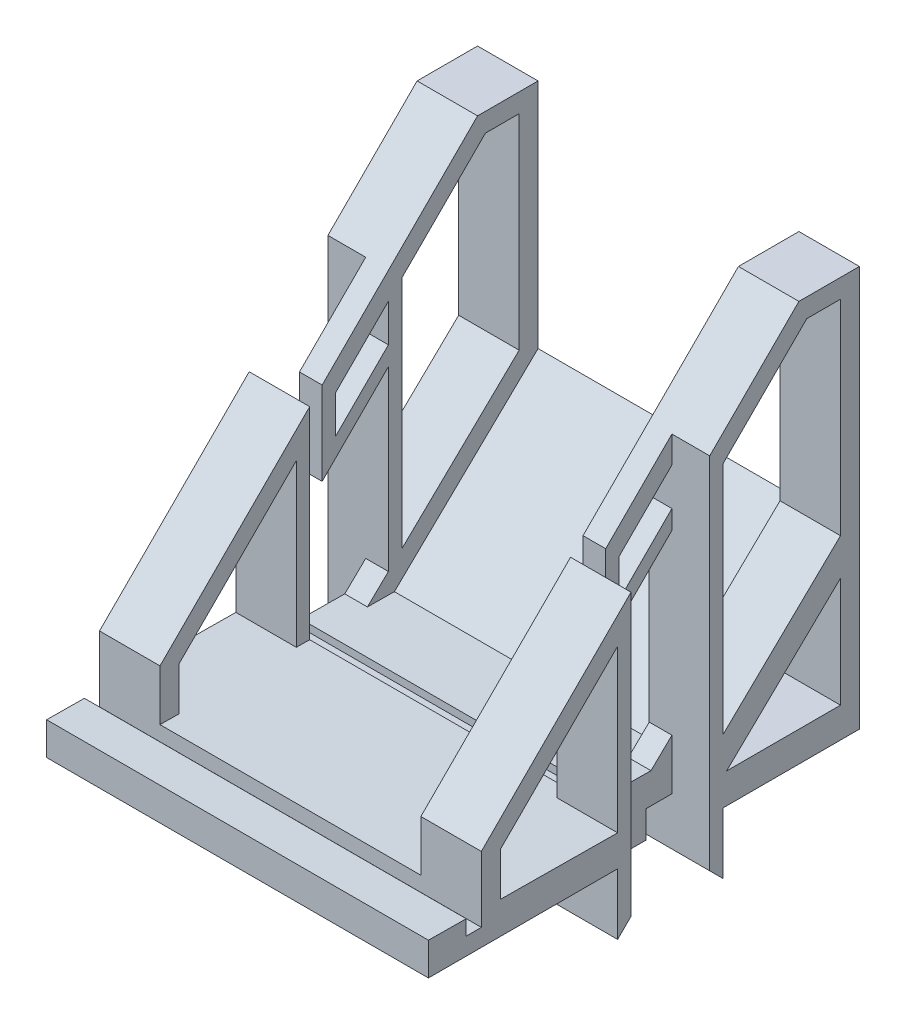
from build123d import *

# Parameters (mm, degrees)
BOSS_EXTRUDE1_DEPTH = 17.25
BOSS_EXTRUDE2_DEPTH = 3
BOSS_EXTRUDE3_START = -20.25
BOSS_EXTRUDE3_DEPTH = 40.5
BOSS_EXTRUDE5_DEPTH = 3
BOSS_EXTRUDE6_DEPTH = 5
SKETCH9_W           = 1.8
SKETCH9_H           = 1
CUT_EXTRUDE2_DEPTH  = 20.25
BOSS_EXTRUDE7_DEPTH = 3


with BuildPart() as part:
    # Sketch1 → Boss-Extrude1 (new body)
    # profile 1 of 3: a face of its own
    with BuildSketch(Plane(origin=(0, 0, 0), x_dir=(0, 0, -1), z_dir=(1, 0, 0))):
        Polygon((0, 0), (5, 0), (5, -1.7), (7, -1.7), (7, 0), (38, 0), (57, 18.348086721), (57, -4), (33.8, -4), (33.8, -7.6), (30.2, -7.6), (30.2, -4), (0, -4), align=None)
        Polygon((54.5, 14.543701193), (39.43955654, 0), (54.5, 0), align=None, mode=Mode.SUBTRACT)
    # profile 2 of 3: a face of its own
    with BuildSketch(Plane(origin=(0, 0, 0), x_dir=(0, 0, -1), z_dir=(1, 0, 0))):
        Polygon((26.795, -4), (26.795, -10.332233047), (25.027233047, -12.1), (25.027233047, -4), align=None)
    # profile 3 of 3: a face of its own
    with BuildSketch(Plane(origin=(0, 0, 0), x_dir=(0, 0, -1), z_dir=(1, 0, 0))):
        Polygon((37.205, -4), (37.205, -10.332233047), (38.972766953, -12.1), (38.972766953, -4), align=None)
    boss_extrude1 = extrude(amount=BOSS_EXTRUDE1_DEPTH)

    # Sketch3 → Boss-Extrude2 (add)
    with BuildSketch(Plane(origin=(17.25, 0, 0), x_dir=(0, 0, -1), z_dir=(1, 0, 0))):
        Polygon((57, -4), (57, 49), (49, 49), (7, 7), (7, -1.7), (5, -1.7), (5, 0), (0, 0), (0, -4), (25.027233047, -4), (25.027233047, -12.1), (26.795, -10.332233047), (26.795, -4), (30.2, -4), (30.2, -7.6), (33.8, -7.6), (33.8, -4), (37.205, -4), (37.205, -10.332233047), (38.972766953, -12.1), (38.972766953, -4), align=None)
        Polygon((9.5, 5.964466094), (9.5, 0), (34.401108651, 0), (54.5, 19.409273762), (54.5, 46.5), (50.035533906, 46.5), align=None, mode=Mode.SUBTRACT)
        Polygon((39.43955654, 0), (54.5, 0), (54.5, 14.543701193), align=None, mode=Mode.SUBTRACT)
    boss_extrude2 = extrude(amount=BOSS_EXTRUDE2_DEPTH)

    # Mirror1: Boss-Extrude1, Boss-Extrude2 across plane
    add(boss_extrude1.mirror(Plane(origin=(0, 0, 0), x_dir=(0, 0, 1), z_dir=(1, 0, 0))))
    add(boss_extrude2.mirror(Plane(origin=(0, 0, 0), x_dir=(0, 0, 1), z_dir=(1, 0, 0))))

    # Sketch1<3> → Boss-Extrude3 (add)
    with BuildSketch(Plane(origin=(0, 0, 0), x_dir=(0, 0, -1), z_dir=(1, 0, 0)).offset(BOSS_EXTRUDE3_START)):
        Polygon((38, 0), (7, 0.270532902), (7, 0), align=None)
        Polygon((5, 0.287986637), (0, 0.331620976), (0, 0), (5, 0), align=None)
    extrude(amount=BOSS_EXTRUDE3_DEPTH)

    # Sketch6 → Boss-Extrude5 (add)
    with BuildSketch(Plane.ZY.offset(20.25)):
        Polygon((-37.205, 2.707686402), (-37.205, 33.669466094), (-38.972766953, 35.437233047), (-38.972766953, 4.414799105), align=None)
        Polygon((-26.795, 0.097784554), (-25.027233047, 0.113211622), (-25.027233047, 21.491699141), (-26.795, 23.259466094), align=None)
    boss_extrude5 = extrude(amount=-BOSS_EXTRUDE5_DEPTH)

    # Sketch8 → Boss-Extrude6 (add)
    # profile 1 of 2: a face of its own
    with BuildSketch(Plane.ZY.offset(20.25)):
        Polygon((-37.205, 33.669466094), (-37.205, 37.205), (-49, 49), (-57, 49), (-57, -4), (-38.972766953, -4), (-38.972766953, -12.1), (-37.205, -10.332233047), (-37.205, -4), (-37.205, 2.707686402), align=None)
        Polygon((-39.43955654, 0), (-54.5, 0), (-54.5, 14.543701193), align=None, mode=Mode.SUBTRACT)
        Polygon((-54.5, 19.409273762), (-54.5, 46.5), (-50.035533906, 46.5), (-38.972766953, 35.437233047), (-38.972766953, 4.414799105), align=None, mode=Mode.SUBTRACT)
    # profile 2 of 2: a face of its own
    with BuildSketch(Plane.ZY.offset(20.25)):
        Polygon((-5, 0.287986637), (-5, -1.7), (-7, -1.7), (-7, 7), (-26.795, 26.795), (-26.795, 23.259466094), (-26.795, 0.097784554), (-26.795, -4), (-26.795, -10.332233047), (-25.027233047, -12.1), (-25.027233047, -4), (0, -4), (0, 0.331620976), align=None)
        Polygon((-25.027233047, 0.113211622), (-25.027233047, 21.491699141), (-9.5, 5.964466094), (-9.5, 0.248715732), align=None, mode=Mode.SUBTRACT)
    boss_extrude6 = extrude(amount=BOSS_EXTRUDE6_DEPTH)

    # Sketch9 → Cut-Extrude2 (cut)
    with BuildSketch(Plane.ZY.offset(20.25)):
        Polygon((-28.445, 17.406308089), (-28.445, 24.909466094), (-30.215, 26.679466094), (-30.215, 21.679466094), (-37.205, 28.669466094), (-37.205, 26.166308089), align=None)
        Polygon((-26.795, 23.259466094), (-26.795, 26.795), (-28.445, 28.445), (-28.445, 24.909466094), align=None)
        with Locations((-27.695, -0.402215446)):
            Rectangle(SKETCH9_W, SKETCH9_H)
    cut_extrude2 = extrude(amount=-CUT_EXTRUDE2_DEPTH, mode=Mode.SUBTRACT)

    # Sketch9<3> → Boss-Extrude7 (add)
    with BuildSketch(Plane.ZY.offset(20.25)):
        Polygon((-28.445, 17.406308089), (-28.445, 24.909466094), (-30.215, 26.679466094), (-30.215, 21.679466094), (-37.205, 28.669466094), (-37.205, 26.166308089), align=None)
    boss_extrude7 = extrude(amount=-BOSS_EXTRUDE7_DEPTH)

    # Mirror2: Boss-Extrude5, Boss-Extrude6, Cut-Extrude2, Boss-Extrude7 across plane
    add(boss_extrude5.mirror(Plane(origin=(0, 0, 0), x_dir=(0, 0, 1), z_dir=(1, 0, 0))))
    add(boss_extrude6.mirror(Plane(origin=(0, 0, 0), x_dir=(0, 0, 1), z_dir=(1, 0, 0))))
    add(cut_extrude2.mirror(Plane(origin=(0, 0, 0), x_dir=(0, 0, 1), z_dir=(1, 0, 0))), mode=Mode.SUBTRACT)
    add(boss_extrude7.mirror(Plane(origin=(0, 0, 0), x_dir=(0, 0, 1), z_dir=(1, 0, 0))))


solid = part.part
